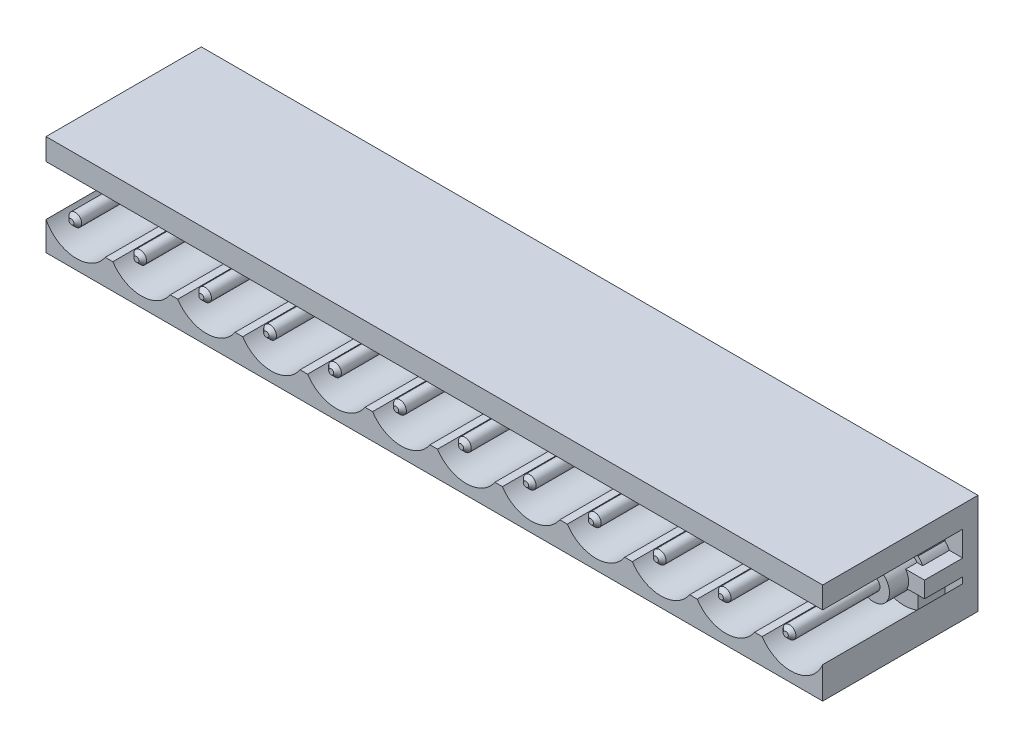
from build123d import *

# Parameters (mm, degrees)
SKETCH1_W                  = 12.2
SKETCH1_H                  = 7.9
BOSS_EXTRUDE1_DEPTH        = 30.5
CUT_EXTRUDE4_DEPTH         = 11
BOSS_EXTRUDE2_DEPTH        = 2.1
SKETCH4_W                  = 61
SKETCH4_H                  = 1.276898398
BOSS_EXTRUDE3_DEPTH        = 3
SKETCH6_R                  = 1.25
BOSS_EXTRUDE4_DEPTH        = 4.5
SKETCH7_R                  = 0.5
BOSS_EXTRUDE5_DEPTH        = 6.9
CHAMFER1_SIZE              = 0.3
LPATTERN2_COUNT            = 12
LPATTERN2_PITCH            = 5.1
CHAMFER1_OF_LPATTERN2_SIZE = 0.3


with BuildPart() as part:
    # Sketch1 → Boss-Extrude1 (new, symmetric)
    with BuildSketch(Plane(origin=(0, 0, 0), x_dir=(0, 0, -1), z_dir=(1, 0, 0))):
        Rectangle(SKETCH1_W, SKETCH1_H)
    extrude(amount=BOSS_EXTRUDE1_DEPTH, both=True)

    # Sketch2 → Cut-Extrude4 (cut)
    with BuildSketch(Plane.XY.offset(6.1)):
        with BuildLine():
            Line((25.6, 2.25), (25.3, 2.25))
            Line((25.3, 2.25), (20.5, 2.25))
            Line((20.5, 2.25), (20.2, 2.25))
            Line((20.2, 2.25), (15.4, 2.25))
            Line((15.4, 2.25), (15.1, 2.25))
            Line((15.1, 2.25), (10.3, 2.25))
            Line((10.3, 2.25), (10, 2.25))
            Line((10, 2.25), (5.2, 2.25))
            Line((5.2, 2.25), (4.9, 2.25))
            Line((4.9, 2.25), (0.1, 2.25))
            Line((0.1, 2.25), (-0.2, 2.25))
            Line((-0.2, 2.25), (-5, 2.25))
            Line((-5, 2.25), (-5.3, 2.25))
            Line((-5.3, 2.25), (-10.1, 2.25))
            Line((-10.1, 2.25), (-10.4, 2.25))
            Line((-10.4, 2.25), (-15.2, 2.25))
            Line((-15.2, 2.25), (-15.5, 2.25))
            Line((-15.5, 2.25), (-20.3, 2.25))
            Line((-20.3, 2.25), (-20.6, 2.25))
            Line((-20.6, 2.25), (-25.4, 2.25))
            Line((-25.4, 2.25), (-25.7, 2.25))
            Line((-25.7, 2.25), (-30.8, 2.25))
            Line((-30.8, 2.25), (-30.8, -0.45))
            ThreePointArc((-30.8, -0.45), (-28.876540721, -3.035920438), (-25.846678141, -1.937461126))
            Line((-25.846678141, -1.937461126), (-25.253321859, -1.937461126))
            ThreePointArc((-25.253321859, -1.937461126), (-23, -3.15), (-20.746678141, -1.937461126))
            Line((-20.746678141, -1.937461126), (-20.153321859, -1.937461126))
            ThreePointArc((-20.153321859, -1.937461126), (-17.9, -3.15), (-15.646678141, -1.937461126))
            Line((-15.646678141, -1.937461126), (-15.053321859, -1.937461126))
            ThreePointArc((-15.053321859, -1.937461126), (-12.8, -3.15), (-10.546678141, -1.937461126))
            Line((-10.546678141, -1.937461126), (-9.953321859, -1.937461126))
            ThreePointArc((-9.953321859, -1.937461126), (-7.7, -3.15), (-5.446678141, -1.937461126))
            Line((-5.446678141, -1.937461126), (-4.853321859, -1.937461126))
            ThreePointArc((-4.853321859, -1.937461126), (-2.6, -3.15), (-0.346678141, -1.937461126))
            Line((-0.346678141, -1.937461126), (0.246678141, -1.937461126))
            ThreePointArc((0.246678141, -1.937461126), (2.5, -3.15), (4.753321859, -1.937461126))
            Line((4.753321859, -1.937461126), (5.346678141, -1.937461126))
            ThreePointArc((5.346678141, -1.937461126), (7.6, -3.15), (9.853321859, -1.937461126))
            Line((9.853321859, -1.937461126), (10.446678141, -1.937461126))
            ThreePointArc((10.446678141, -1.937461126), (12.7, -3.15), (14.953321859, -1.937461126))
            Line((14.953321859, -1.937461126), (15.546678141, -1.937461126))
            ThreePointArc((15.546678141, -1.937461126), (17.8, -3.15), (20.053321859, -1.937461126))
            Line((20.053321859, -1.937461126), (20.646678141, -1.937461126))
            ThreePointArc((20.646678141, -1.937461126), (22.9, -3.15), (25.153321859, -1.937461126))
            Line((25.153321859, -1.937461126), (25.746678141, -1.937461126))
            ThreePointArc((25.746678141, -1.937461126), (28.776540721, -3.035920438), (30.7, -0.45))
            Line((30.7, -0.45), (30.7, 2.25))
            Line((30.7, 2.25), (25.6, 2.25))
        make_face()
    extrude(amount=-CUT_EXTRUDE4_DEPTH, mode=Mode.SUBTRACT)

    # Sketch3 → Boss-Extrude2 (add)
    with BuildSketch(Plane.XY.offset(-4.9)):
        with BuildLine():
            Line((-29.193193683, -1.655999684), (-29.193193683, -3.440497475))
            Line((-29.193193683, -3.440497475), (-27.006806317, -3.440497475))
            Line((-27.006806317, -3.440497475), (-27.006806317, -1.655999684))
            ThreePointArc((-27.006806317, -1.655999684), (-26.472269166, -0.45), (-27.006806317, 0.755999684))
            Line((-27.006806317, 0.755999684), (-27.006806317, 2.540497475))
            Line((-27.006806317, 2.540497475), (-29.193193683, 2.540497475))
            Line((-29.193193683, 2.540497475), (-29.193193683, 0.755999684))
            ThreePointArc((-29.193193683, 0.755999684), (-29.727730834, -0.45), (-29.193193683, -1.655999684))
        make_face()
        with BuildLine():
            Line((-24.093193683, 2.540497475), (-21.906806317, 2.540497475))
            Line((-21.906806317, 2.540497475), (-21.906806317, 0.755999684))
            ThreePointArc((-21.906806317, 0.755999684), (-21.372269166, -0.45), (-21.906806317, -1.655999684))
            Line((-21.906806317, -1.655999684), (-21.906806317, -3.440497475))
            Line((-21.906806317, -3.440497475), (-24.093193683, -3.440497475))
            Line((-24.093193683, -3.440497475), (-24.093193683, -1.655999684))
            ThreePointArc((-24.093193683, -1.655999684), (-24.627730834, -0.45), (-24.093193683, 0.755999684))
            Line((-24.093193683, 0.755999684), (-24.093193683, 2.540497475))
        make_face()
        with BuildLine():
            Line((-18.993193683, 2.540497475), (-16.806806317, 2.540497475))
            Line((-16.806806317, 2.540497475), (-16.806806317, 0.755999684))
            ThreePointArc((-16.806806317, 0.755999684), (-16.272269166, -0.45), (-16.806806317, -1.655999684))
            Line((-16.806806317, -1.655999684), (-16.806806317, -3.440497475))
            Line((-16.806806317, -3.440497475), (-18.993193683, -3.440497475))
            Line((-18.993193683, -3.440497475), (-18.993193683, -1.655999684))
            ThreePointArc((-18.993193683, -1.655999684), (-19.527730834, -0.45), (-18.993193683, 0.755999684))
            Line((-18.993193683, 0.755999684), (-18.993193683, 2.540497475))
        make_face()
        with BuildLine():
            Line((-13.893193683, 2.540497475), (-11.706806317, 2.540497475))
            Line((-11.706806317, 2.540497475), (-11.706806317, 0.755999684))
            ThreePointArc((-11.706806317, 0.755999684), (-11.172269166, -0.45), (-11.706806317, -1.655999684))
            Line((-11.706806317, -1.655999684), (-11.706806317, -3.440497475))
            Line((-11.706806317, -3.440497475), (-13.893193683, -3.440497475))
            Line((-13.893193683, -3.440497475), (-13.893193683, -1.655999684))
            ThreePointArc((-13.893193683, -1.655999684), (-14.427730834, -0.45), (-13.893193683, 0.755999684))
            Line((-13.893193683, 0.755999684), (-13.893193683, 2.540497475))
        make_face()
        with BuildLine():
            Line((-8.793193683, 2.540497475), (-6.606806317, 2.540497475))
            Line((-6.606806317, 2.540497475), (-6.606806317, 0.755999684))
            ThreePointArc((-6.606806317, 0.755999684), (-6.072269166, -0.45), (-6.606806317, -1.655999684))
            Line((-6.606806317, -1.655999684), (-6.606806317, -3.440497475))
            Line((-6.606806317, -3.440497475), (-8.793193683, -3.440497475))
            Line((-8.793193683, -3.440497475), (-8.793193683, -1.655999684))
            ThreePointArc((-8.793193683, -1.655999684), (-9.327730834, -0.45), (-8.793193683, 0.755999684))
            Line((-8.793193683, 0.755999684), (-8.793193683, 2.540497475))
        make_face()
        with BuildLine():
            Line((-3.693193683, 2.540497475), (-1.506806317, 2.540497475))
            Line((-1.506806317, 2.540497475), (-1.506806317, 0.755999684))
            ThreePointArc((-1.506806317, 0.755999684), (-0.972269166, -0.45), (-1.506806317, -1.655999684))
            Line((-1.506806317, -1.655999684), (-1.506806317, -3.440497475))
            Line((-1.506806317, -3.440497475), (-3.693193683, -3.440497475))
            Line((-3.693193683, -3.440497475), (-3.693193683, -1.655999684))
            ThreePointArc((-3.693193683, -1.655999684), (-4.227730834, -0.45), (-3.693193683, 0.755999684))
            Line((-3.693193683, 0.755999684), (-3.693193683, 2.540497475))
        make_face()
        with BuildLine():
            Line((1.406806317, 2.540497475), (3.593193683, 2.540497475))
            Line((3.593193683, 2.540497475), (3.593193683, 0.755999684))
            ThreePointArc((3.593193683, 0.755999684), (4.127730834, -0.45), (3.593193683, -1.655999684))
            Line((3.593193683, -1.655999684), (3.593193683, -3.440497475))
            Line((3.593193683, -3.440497475), (1.406806317, -3.440497475))
            Line((1.406806317, -3.440497475), (1.406806317, -1.655999684))
            ThreePointArc((1.406806317, -1.655999684), (0.872269166, -0.45), (1.406806317, 0.755999684))
            Line((1.406806317, 0.755999684), (1.406806317, 2.540497475))
        make_face()
        with BuildLine():
            Line((6.506806317, 2.540497475), (8.693193683, 2.540497475))
            Line((8.693193683, 2.540497475), (8.693193683, 0.755999684))
            ThreePointArc((8.693193683, 0.755999684), (9.227730834, -0.45), (8.693193683, -1.655999684))
            Line((8.693193683, -1.655999684), (8.693193683, -3.440497475))
            Line((8.693193683, -3.440497475), (6.506806317, -3.440497475))
            Line((6.506806317, -3.440497475), (6.506806317, -1.655999684))
            ThreePointArc((6.506806317, -1.655999684), (5.972269166, -0.45), (6.506806317, 0.755999684))
            Line((6.506806317, 0.755999684), (6.506806317, 2.540497475))
        make_face()
        with BuildLine():
            Line((11.606806317, 2.540497475), (13.793193683, 2.540497475))
            Line((13.793193683, 2.540497475), (13.793193683, 0.755999684))
            ThreePointArc((13.793193683, 0.755999684), (14.327730834, -0.45), (13.793193683, -1.655999684))
            Line((13.793193683, -1.655999684), (13.793193683, -3.440497475))
            Line((13.793193683, -3.440497475), (11.606806317, -3.440497475))
            Line((11.606806317, -3.440497475), (11.606806317, -1.655999684))
            ThreePointArc((11.606806317, -1.655999684), (11.072269166, -0.45), (11.606806317, 0.755999684))
            Line((11.606806317, 0.755999684), (11.606806317, 2.540497475))
        make_face()
        with BuildLine():
            Line((16.706806317, 2.540497475), (18.893193683, 2.540497475))
            Line((18.893193683, 2.540497475), (18.893193683, 0.755999684))
            ThreePointArc((18.893193683, 0.755999684), (19.427730834, -0.45), (18.893193683, -1.655999684))
            Line((18.893193683, -1.655999684), (18.893193683, -3.440497475))
            Line((18.893193683, -3.440497475), (16.706806317, -3.440497475))
            Line((16.706806317, -3.440497475), (16.706806317, -1.655999684))
            ThreePointArc((16.706806317, -1.655999684), (16.172269166, -0.45), (16.706806317, 0.755999684))
            Line((16.706806317, 0.755999684), (16.706806317, 2.540497475))
        make_face()
        with BuildLine():
            Line((21.806806317, 2.540497475), (23.993193683, 2.540497475))
            Line((23.993193683, 2.540497475), (23.993193683, 0.755999684))
            ThreePointArc((23.993193683, 0.755999684), (24.527730834, -0.45), (23.993193683, -1.655999684))
            Line((23.993193683, -1.655999684), (23.993193683, -3.440497475))
            Line((23.993193683, -3.440497475), (21.806806317, -3.440497475))
            Line((21.806806317, -3.440497475), (21.806806317, -1.655999684))
            ThreePointArc((21.806806317, -1.655999684), (21.272269166, -0.45), (21.806806317, 0.755999684))
            Line((21.806806317, 0.755999684), (21.806806317, 2.540497475))
        make_face()
        with BuildLine():
            Line((26.906806317, 2.540497475), (29.093193683, 2.540497475))
            Line((29.093193683, 2.540497475), (29.093193683, 0.755999684))
            ThreePointArc((29.093193683, 0.755999684), (29.627730834, -0.45), (29.093193683, -1.655999684))
            Line((29.093193683, -1.655999684), (29.093193683, -3.440497475))
            Line((29.093193683, -3.440497475), (26.906806317, -3.440497475))
            Line((26.906806317, -3.440497475), (26.906806317, -1.655999684))
            ThreePointArc((26.906806317, -1.655999684), (26.372269166, -0.45), (26.906806317, 0.755999684))
            Line((26.906806317, 0.755999684), (26.906806317, 2.540497475))
        make_face()
    extrude(amount=BOSS_EXTRUDE2_DEPTH)

    # Sketch4 → Boss-Extrude3 (add)
    with BuildSketch(Plane.XY.offset(-4.9)):
        with Locations((0, -0.356915043)):
            Rectangle(SKETCH4_W, SKETCH4_H)
    extrude(amount=BOSS_EXTRUDE3_DEPTH)

    # Sketch6 → Boss-Extrude4 (add)
    with BuildSketch(Plane.XY.offset(-4.9)):
        with Locations(Location((-28.1, -0.45, 0), (0, 0, 205.867495762))):
            Circle(SKETCH6_R)
        with Locations(Location((-23, -0.45, 0), (0, 0, 205.867495762))):
            Circle(SKETCH6_R)
        with Locations(Location((-17.9, -0.45, 0), (0, 0, 205.867495762))):
            Circle(SKETCH6_R)
        with Locations(Location((-12.8, -0.45, 0), (0, 0, 205.867495762))):
            Circle(SKETCH6_R)
        with Locations(Location((-7.7, -0.45, 0), (0, 0, 205.867495762))):
            Circle(SKETCH6_R)
        with Locations(Location((-2.6, -0.45, 0), (0, 0, 205.867495762))):
            Circle(SKETCH6_R)
        with Locations(Location((2.5, -0.45, 0), (0, 0, 205.867495762))):
            Circle(SKETCH6_R)
        with Locations(Location((7.6, -0.45, 0), (0, 0, 205.867495762))):
            Circle(SKETCH6_R)
        with Locations(Location((12.7, -0.45, 0), (0, 0, 205.867495762))):
            Circle(SKETCH6_R)
        with Locations(Location((17.8, -0.45, 0), (0, 0, 205.867495762))):
            Circle(SKETCH6_R)
        with Locations(Location((22.9, -0.45, 0), (0, 0, 205.867495762))):
            Circle(SKETCH6_R)
        with Locations(Location((28, -0.45, 0), (0, 0, 205.867495762))):
            Circle(SKETCH6_R)
    extrude(amount=BOSS_EXTRUDE4_DEPTH)

    # Sketch7 → Boss-Extrude5 (add)
    with BuildSketch(Plane.XY.offset(-0.4)):
        with Locations((-28.1, -0.45)):
            Circle(SKETCH7_R)
    boss_extrude5 = extrude(amount=BOSS_EXTRUDE5_DEPTH)

    # Chamfer1
    chamfer1_edges = [part.edges().sort_by_distance(p)[0] for p in [
        (-28.6, -0.45, 6.5),
    ]]
    chamfer(chamfer1_edges, length=CHAMFER1_SIZE)

    # LPattern2: Boss-Extrude5 ×12
    with Locations(*[(i * LPATTERN2_PITCH, 0, 0) for i in range(1, LPATTERN2_COUNT)]):
        add(boss_extrude5)

    # Chamfer1 of LPattern2
    chamfer1_of_lpattern2_edges = [part.edges().sort_by_distance(p)[0] for p in [
        (-23.5, -0.45, 6.5),
        (-18.4, -0.45, 6.5),
        (-13.3, -0.45, 6.5),
        (-8.2, -0.45, 6.5),
        (-3.1, -0.45, 6.5),
        (2, -0.45, 6.5),
        (7.1, -0.45, 6.5),
        (12.2, -0.45, 6.5),
        (17.3, -0.45, 6.5),
        (22.4, -0.45, 6.5),
        (27.5, -0.45, 6.5),
    ]]
    chamfer(chamfer1_of_lpattern2_edges, length=CHAMFER1_OF_LPATTERN2_SIZE)


solid = part.part
